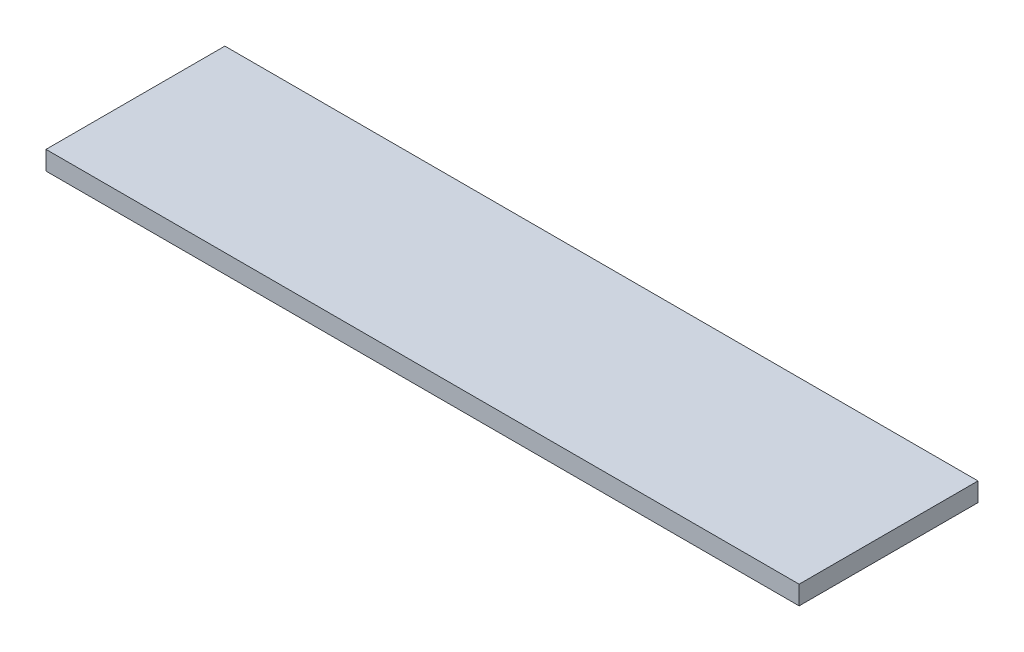
from build123d import *

# Parameters (mm, degrees)
SKETCH1_W           = 400
SKETCH1_H           = 95
BOSS_EXTRUDE1_DEPTH = 10


with BuildPart() as part:
    # Sketch1 → Boss-Extrude1 (new body)
    with BuildSketch(Plane(origin=(0, 0, 0), x_dir=(1, 0, 0), z_dir=(0, 1, 0))):
        Rectangle(SKETCH1_W, SKETCH1_H)
    extrude(amount=BOSS_EXTRUDE1_DEPTH)


solid = part.part
